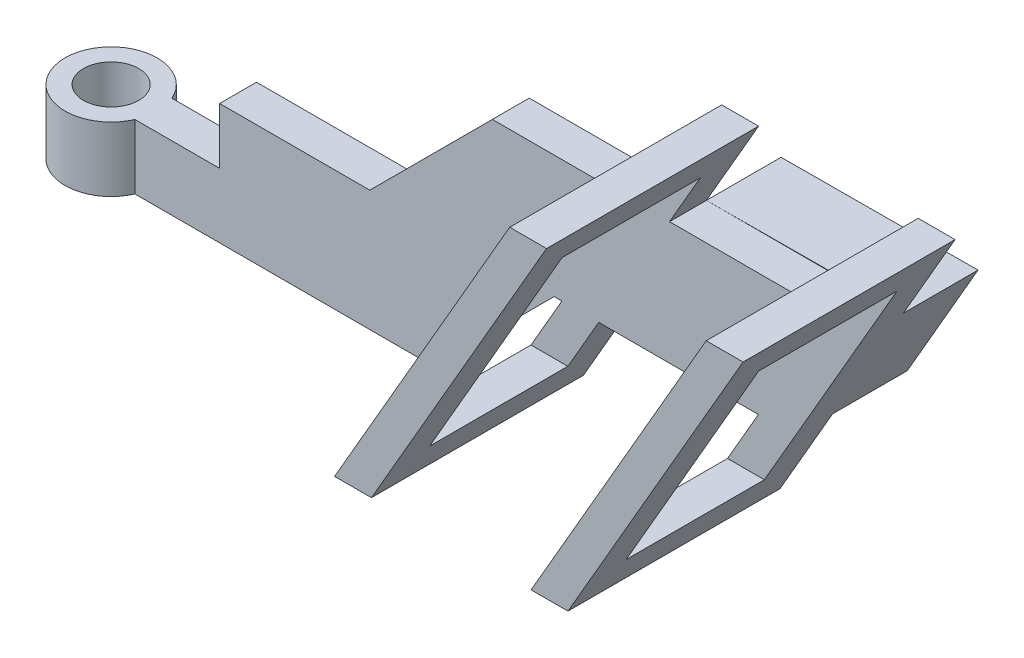
from build123d import *

# Parameters (mm, degrees)
SKETCH1_R           = 5
SKETCH1_R_2         = 3
BOSS_EXTRUDE1_DEPTH = 7
SKETCH2_R           = 3
BOSS_EXTRUDE2_DEPTH = 7
SKETCH3_W           = 16.288395929
SKETCH3_H           = 13.1
BOSS_EXTRUDE3_DEPTH = 4
SKETCH4_W           = 4.517614974
SKETCH4_H           = 7
CUT_EXTRUDE1_DEPTH  = 4
BOSS_EXTRUDE4_DEPTH = 4
BOSS_EXTRUDE5_DEPTH = 4
BOSS_EXTRUDE6_DEPTH = 19
BOSS_EXTRUDE7_DEPTH = 4
BOSS_EXTRUDE8_DEPTH = 8.1


with BuildPart() as part:
    # Sketch1 → Boss-Extrude1 (new body)
    with BuildSketch(Plane(origin=(0, 0, 0), x_dir=(1, 0, 0), z_dir=(0, 1, 0))):
        with Locations(Location((0, 0, 0), (0, 0, 270))):
            Circle(SKETCH1_R)
        with Locations(Location((0, 0, 0), (0, 0, 270))):
            Circle(SKETCH1_R_2, mode=Mode.SUBTRACT)
    extrude(amount=BOSS_EXTRUDE1_DEPTH)

    # Sketch2 → Boss-Extrude2 (add, through all)
    with BuildSketch(Plane(origin=(0, 7, 0), x_dir=(1, 0, 0), z_dir=(0, 1, 0))):
        with BuildLine():
            Line((4.582575695, -2), (34.582575695, -2))
            Line((34.582575695, -2), (34.582575695, 2))
            Line((34.582575695, 2), (4.582575695, 2))
            ThreePointArc((4.582575695, 2), (-5, 0), (4.582575695, -2))
        make_face()
        with Locations(Location((0, 0, 0), (0, 0, 270))):
            Circle(SKETCH2_R, mode=Mode.SUBTRACT)
    extrude(amount=-BOSS_EXTRUDE2_DEPTH)

    # Sketch3 → Boss-Extrude3 (add)
    with BuildSketch(Plane.XY.offset(2)):
        with Locations((21.920762757, 6.55)):
            Rectangle(SKETCH3_W, SKETCH3_H)
    extrude(amount=-BOSS_EXTRUDE3_DEPTH)

    # Sketch4 → Cut-Extrude1 (cut)
    with BuildSketch(Plane.XY.offset(2)):
        with Locations((32.323768208, 3.5)):
            Rectangle(SKETCH4_W, SKETCH4_H)
    extrude(amount=-CUT_EXTRUDE1_DEPTH, mode=Mode.SUBTRACT)

    # Sketch5 → Boss-Extrude4 (add)
    with BuildSketch(Plane.XY.offset(2)):
        Polygon((30.064960721, 13.1), (30.064960721, 0), (36.964960721, 0), (50.064960721, 13.1), (76.225581431, 13.1), (80.064960721, 19.75), (80.064960721, 26.4), (43.364960721, 26.4), align=None)
    extrude(amount=-BOSS_EXTRUDE4_DEPTH)

    # Sketch6 → Boss-Extrude5 (add)
    with BuildSketch(Plane.XY.offset(2)):
        Polygon((64.244452646, 36.204482672), (68.244452646, 36.204482672), (49.244452646, 3.295517328), (45.244452646, 3.295517328), align=None)
        Polygon((85.564960721, 36.204482672), (89.564960721, 36.204482672), (70.564960721, 3.295517328), (66.564960721, 3.295517328), align=None)
    extrude(amount=-BOSS_EXTRUDE5_DEPTH)

    # Sketch7 → Boss-Extrude6 (add)
    with BuildSketch(Plane.XY.offset(2)):
        Polygon((68.244452646, 36.204482672), (64.244452646, 36.204482672), (61.935051569, 32.204482672), (65.935051569, 32.204482672), align=None)
        Polygon((85.564960721, 36.204482672), (89.564960721, 36.204482672), (87.255559645, 32.204482672), (83.255559645, 32.204482672), align=None)
        Polygon((66.564960721, 3.295517328), (70.564960721, 3.295517328), (72.874361798, 7.295517328), (68.874361798, 7.295517328), align=None)
        Polygon((45.244452646, 3.295517328), (49.244452646, 3.295517328), (51.553853723, 7.295517328), (47.553853723, 7.295517328), align=None)
    extrude(amount=BOSS_EXTRUDE6_DEPTH)

    # Sketch8 → Boss-Extrude7 (add)
    with BuildSketch(Plane.XY.offset(21)):
        Polygon((64.244452646, 36.204482672), (68.244452646, 36.204482672), (49.244452646, 3.295517328), (45.244452646, 3.295517328), align=None)
        Polygon((85.564960721, 36.204482672), (89.564960721, 36.204482672), (70.564960721, 3.295517328), (66.564960721, 3.295517328), align=None)
    extrude(amount=-BOSS_EXTRUDE7_DEPTH)

    # Sketch9 → Boss-Extrude8 (add)
    with BuildSketch(Plane(origin=(0, 0, -2), x_dir=(-1, 0, 0), z_dir=(0, 0, -1))):
        Polygon((-54.905073356, 13.1), (-62.583831936, 26.4), (-83.95273694, 26.483825938), (-76.273978359, 13.183825938), align=None)
    extrude(amount=BOSS_EXTRUDE8_DEPTH)


solid = part.part
